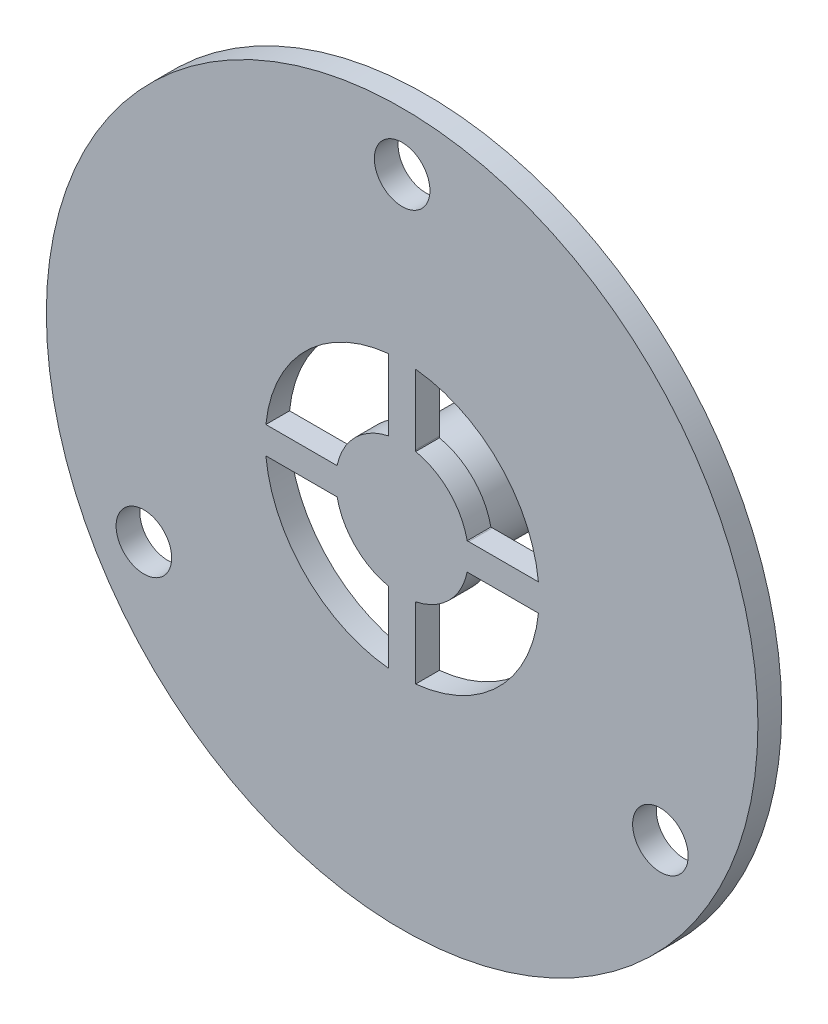
from build123d import *

# Parameters (mm, degrees)
SKETCH2_R           = 52.5
SKETCH2_R_2         = 4.1
BOSS_EXTRUDE1_DEPTH = 3.5
SKETCH3_R           = 20.207259422
CUT_EXTRUDE1_DEPTH  = 11.8
BOSS_EXTRUDE2_DEPTH = 3.5
SKETCH5_R           = 7.781762147
BOSS_EXTRUDE3_DEPTH = 11.8


with BuildPart() as part:
    # Sketch2 → Boss-Extrude1 (new body)
    with BuildSketch(Plane.XY):
        Circle(SKETCH2_R)
        with Locations((0, 44)):
            Circle(SKETCH2_R_2, mode=Mode.SUBTRACT)
        with Locations((38.105117767, -22)):
            Circle(SKETCH2_R_2, mode=Mode.SUBTRACT)
        with Locations((-38.105117767, -22)):
            Circle(SKETCH2_R_2, mode=Mode.SUBTRACT)
        Polygon((-17.5, 10.103629711), (0, 20.207259422), (17.5, 10.103629711), (17.5, -10.103629711), (0, -20.207259422), (-17.5, -10.103629711), align=None, mode=Mode.SUBTRACT)
    extrude(amount=BOSS_EXTRUDE1_DEPTH)

    # Sketch3 → Cut-Extrude1 (cut)
    with BuildSketch(Plane(origin=(0, 0, 0), x_dir=(-1, 0, 0), z_dir=(0, 0, -1))):
        Circle(SKETCH3_R)
    extrude(amount=-CUT_EXTRUDE1_DEPTH, mode=Mode.SUBTRACT)

    # Sketch4 → Boss-Extrude2 (add)
    with BuildSketch(Plane(origin=(0, 0, 0), x_dir=(-1, 0, 0), z_dir=(0, 0, -1))):
        with BuildLine():
            Line((2, 9.80418615), (2, 34.404657721))
            Line((2, 34.404657721), (-2, 34.404657721))
            Line((-2, 34.404657721), (-2, 9.80418615))
            Line((-2, 9.80418615), (-1.999978972, 9.598028452))
            ThreePointArc((-1.999978972, 9.598028452), (-6.932952502, 6.932260502), (-9.598228039, 1.999020905))
            Line((-9.598228039, 1.999020905), (-9.80318615, 1.999))
            Line((-9.80318615, 1.999), (-34.403657721, 1.999))
            Line((-34.403657721, 1.999), (-34.403657721, -2.001))
            Line((-34.403657721, -2.001), (-9.80318615, -2.001))
            Line((-9.80318615, -2.001), (-9.597820007, -2.000979053))
            ThreePointArc((-9.597820007, -2.000979053), (-6.931538141, -6.933674715), (-1.998020986, -9.598436237))
            Line((-1.998020986, -9.598436237), (-1.998, -9.80418615))
            Line((-1.998, -9.80418615), (-1.998, -34.404657721))
            Line((-1.998, -34.404657721), (2.002, -34.404657721))
            Line((2.002, -34.404657721), (2.002, -9.80418615))
            Line((2.002, -9.80418615), (2.00197893, -9.597611496))
            ThreePointArc((2.00197893, -9.597611496), (6.93367465, -6.931538207), (9.598227996, -1.999021109))
            Line((9.598227996, -1.999021109), (9.80518615, -1.999))
            Line((9.80518615, -1.999), (34.405657721, -1.999))
            Line((34.405657721, -1.999), (34.405657721, 2.001))
            Line((34.405657721, 2.001), (9.80518615, 2.001))
            Line((9.80518615, 2.001), (9.59782005, 2.000978849))
            ThreePointArc((9.59782005, 2.000978849), (6.932260583, 6.93295242), (2.000021028, 9.598019689))
            Line((2.000021028, 9.598019689), (2, 9.80418615))
        make_face()
    extrude(amount=-BOSS_EXTRUDE2_DEPTH)

    # Sketch5 → Boss-Extrude3 (add)
    with BuildSketch(Plane(origin=(0, 0, 0), x_dir=(-1, 0, 0), z_dir=(0, 0, -1))):
        with Locations(Location((0, 0, 0), (0, 0, 180))):
            Circle(SKETCH5_R)
        with BuildLine():
            Line((-3.424908758, 2.6), (3.424908758, 2.6))
            ThreePointArc((3.424908758, 2.6), (0, -4.3), (-3.424908758, 2.6))
        make_face(mode=Mode.SUBTRACT)
    extrude(amount=BOSS_EXTRUDE3_DEPTH)


solid = part.part
